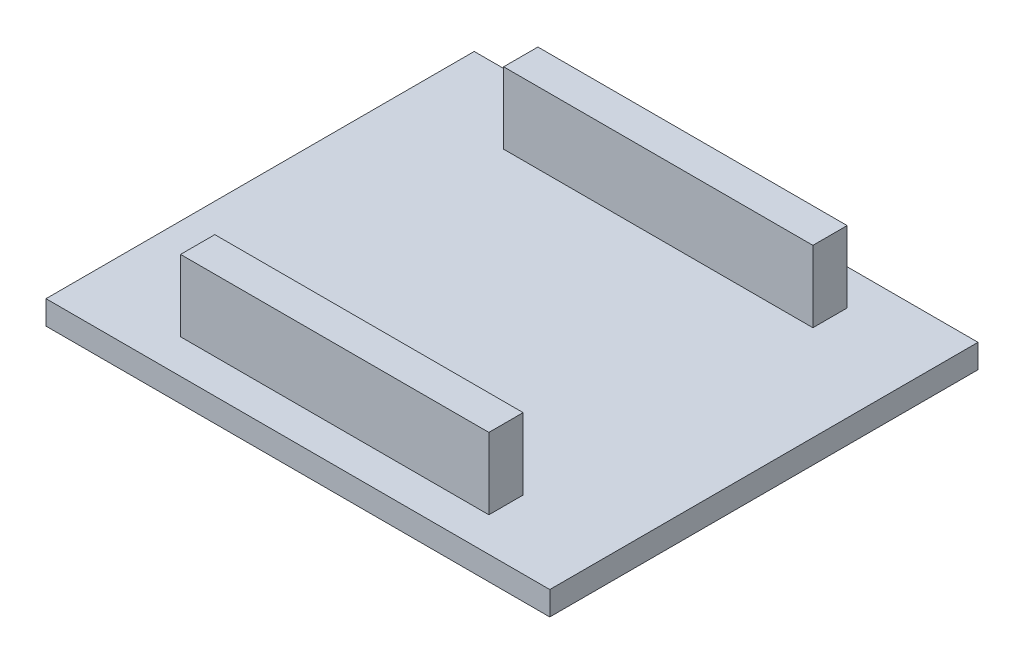
from build123d import *

# Parameters (mm, degrees)
SKETCH1_W           = 33.617647014
SKETCH1_H           = 28.575
BOSS_EXTRUDE1_DEPTH = 1.5875
SKETCH2_W           = 20.574
SKETCH2_H           = 2.286
SKETCH2_W_2         = 20.6375
BOSS_EXTRUDE2_DEPTH = 4.7625


with BuildPart() as part:
    # Sketch1 → Boss-Extrude1 (new body)
    with BuildSketch(Plane(origin=(0, 0, 0), x_dir=(1, 0, 0), z_dir=(0, 1, 0))):
        with Locations((16.808823507, 14.2875)):
            Rectangle(SKETCH1_W, SKETCH1_H)
    extrude(amount=BOSS_EXTRUDE1_DEPTH)

    # Sketch2 → Boss-Extrude2 (add)
    with BuildSketch(Plane(origin=(0, 1.5875, 0), x_dir=(1, 0, 0), z_dir=(0, 1, 0))):
        with Locations((16.980647014, 3.429)):
            Rectangle(SKETCH2_W, SKETCH2_H)
        with Locations((16.948897014, 25.05075)):
            Rectangle(SKETCH2_W_2, SKETCH2_H)
    extrude(amount=BOSS_EXTRUDE2_DEPTH)


solid = part.part
